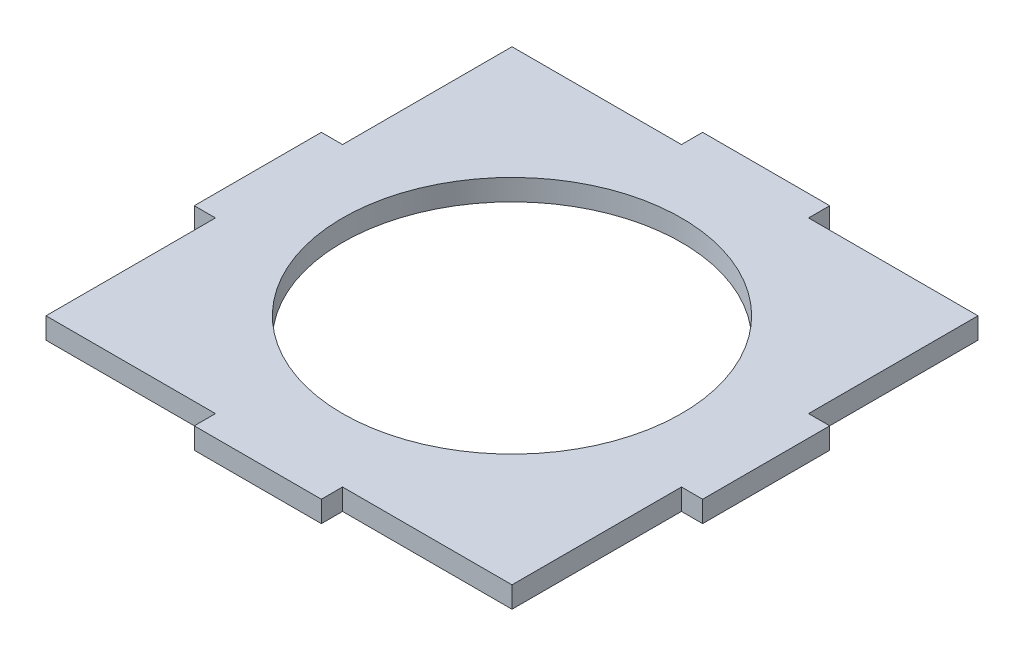
from build123d import *

# Parameters (mm, degrees)
SKETCH1_R           = 50.8
BOSS_EXTRUDE1_DEPTH = 6.35


with BuildPart() as part:
    # Sketch1 → Boss-Extrude1 (new body)
    with BuildSketch(Plane(origin=(0, 0, 0), x_dir=(1, 0, 0), z_dir=(0, 1, 0))):
        Polygon((46.273558235, -27.177818941), (97.073558235, -27.177818941), (97.073558235, 23.622181059), (103.423558235, 23.622181059), (103.423558235, 61.722181059), (97.073558235, 61.722181059), (97.073558235, 112.522181059), (46.273558235, 112.522181059), (46.273558235, 118.872181059), (8.173558235, 118.872181059), (8.173558235, 112.522181059), (-42.626441765, 112.522181059), (-42.626441765, 61.722181059), (-48.976441765, 61.722181059), (-48.976441765, 23.622181059), (-42.626441765, 23.622181059), (-42.626441765, -27.177818941), (8.173558235, -27.177818941), (8.173558235, -33.527818941), (46.273558235, -33.527818941), align=None)
        with Locations((27.223558235, 42.672181059)):
            Circle(SKETCH1_R, mode=Mode.SUBTRACT)
    extrude(amount=BOSS_EXTRUDE1_DEPTH)


solid = part.part
